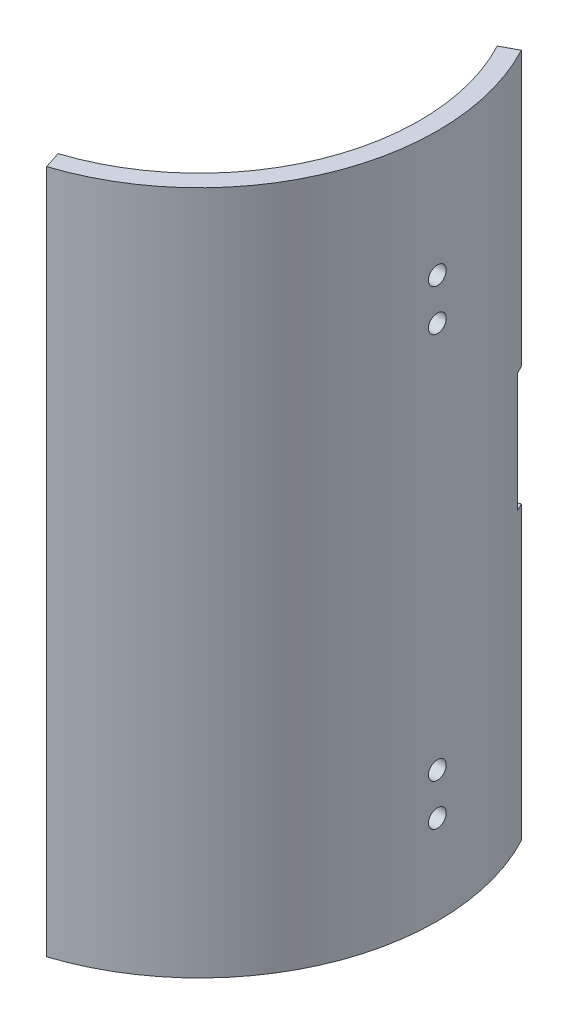
from build123d import *

# Parameters (mm, degrees)
EXTRUSION1_DEPTH = 115
ESQUISSE6_R      = 1.5
ESQUISSE6_W      = 9.82268881
ESQUISSE6_H      = 20
EXTRUSION4_DEPTH = 128.562586974


with BuildPart() as part:
    # Esquisse5 → Extrusion1 (new body)
    with BuildSketch(Plane(origin=(0, 0, 0), x_dir=(1, 0, 0), z_dir=(0, 1, 0))):
        with BuildLine():
            Line((32.669060936, 17.370447823), (35.317903714, 18.778862511))
            ThreePointArc((35.317903714, 18.778862511), (37.087354183, -14.984263737), (12.360679775, -38.042260652))
            Line((12.360679775, -38.042260652), (11.433628792, -35.189091103))
            ThreePointArc((11.433628792, -35.189091103), (34.305802619, -13.860443956), (32.669060936, 17.370447823))
        make_face()
    extrude(amount=EXTRUSION1_DEPTH)

    # Esquisse6 → Extrusion4 (cut, through all)
    with BuildSketch(Plane(origin=(0, 0, 0), x_dir=(0, 0, -1), z_dir=(1, 0, 0))):
        with Locations(Location((0, 94, 0), (0, 0, 180))):
            Circle(ESQUISSE6_R)
        with Locations(Location((0, 87, 0), (0, 0, 180))):
            Circle(ESQUISSE6_R)
        with Locations(Location((0, 15, 0), (0, 0, 180))):
            Circle(ESQUISSE6_R)
        with Locations(Location((0, 22, 0), (0, 0, 180))):
            Circle(ESQUISSE6_R)
        with Locations((22.411344405, 59)):
            Rectangle(ESQUISSE6_W, ESQUISSE6_H)
    extrude(amount=EXTRUSION4_DEPTH, mode=Mode.SUBTRACT)


solid = part.part
